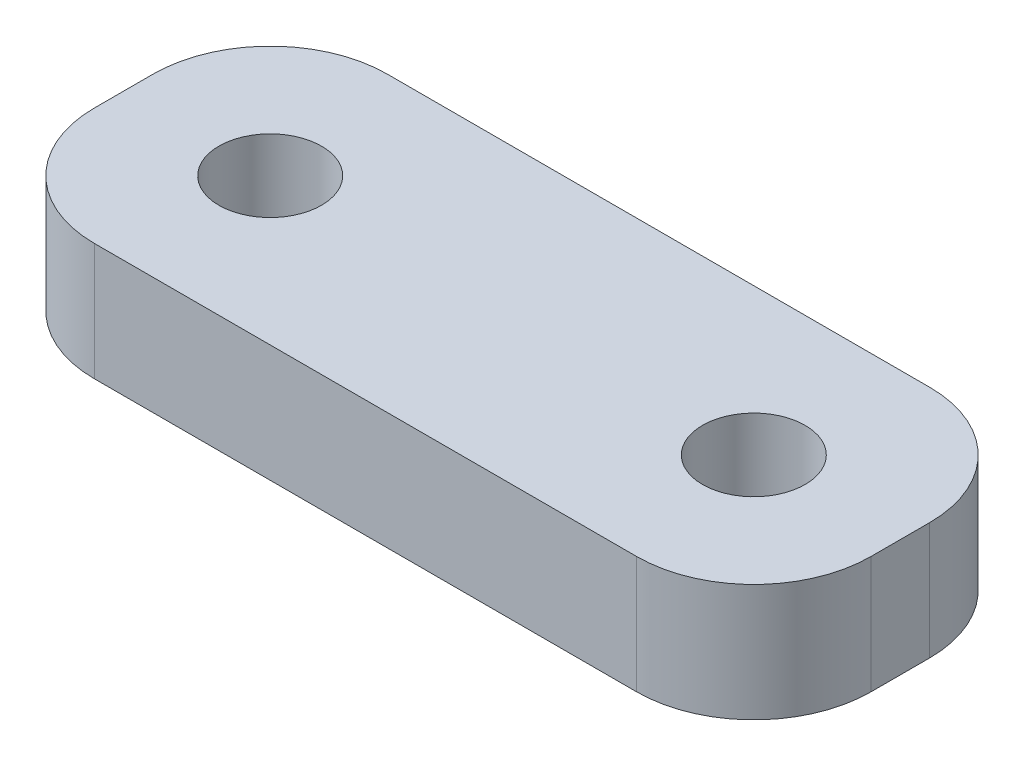
from build123d import *

# Parameters (mm, degrees)
SKETCH1_W           = 26.5
SKETCH1_H           = 10
SKETCH1_R           = 1.75
BOSS_EXTRUDE1_DEPTH = 4
FILLET1_R           = 4


with BuildPart() as part:
    # Sketch1 → Boss-Extrude1 (new body)
    with BuildSketch(Plane(origin=(0, 0, 0), x_dir=(1, 0, 0), z_dir=(0, 1, 0))):
        with Locations((13.25, 5)):
            Rectangle(SKETCH1_W, SKETCH1_H)
        with Locations(Location((5, 5, 0), (0, 0, 270))):
            Circle(SKETCH1_R, mode=Mode.SUBTRACT)
        with Locations(Location((21.5, 5, 0), (0, 0, 270))):
            Circle(SKETCH1_R, mode=Mode.SUBTRACT)
    extrude(amount=BOSS_EXTRUDE1_DEPTH)

    # Fillet1
    fillet1_edges = [part.edges().sort_by_distance(p)[0] for p in [
        (0, 2, -10),
        (26.5, 2, -10),
        (26.5, 2, 0),
        (0, 2, 0),
    ]]
    fillet(fillet1_edges, radius=FILLET1_R)


solid = part.part
